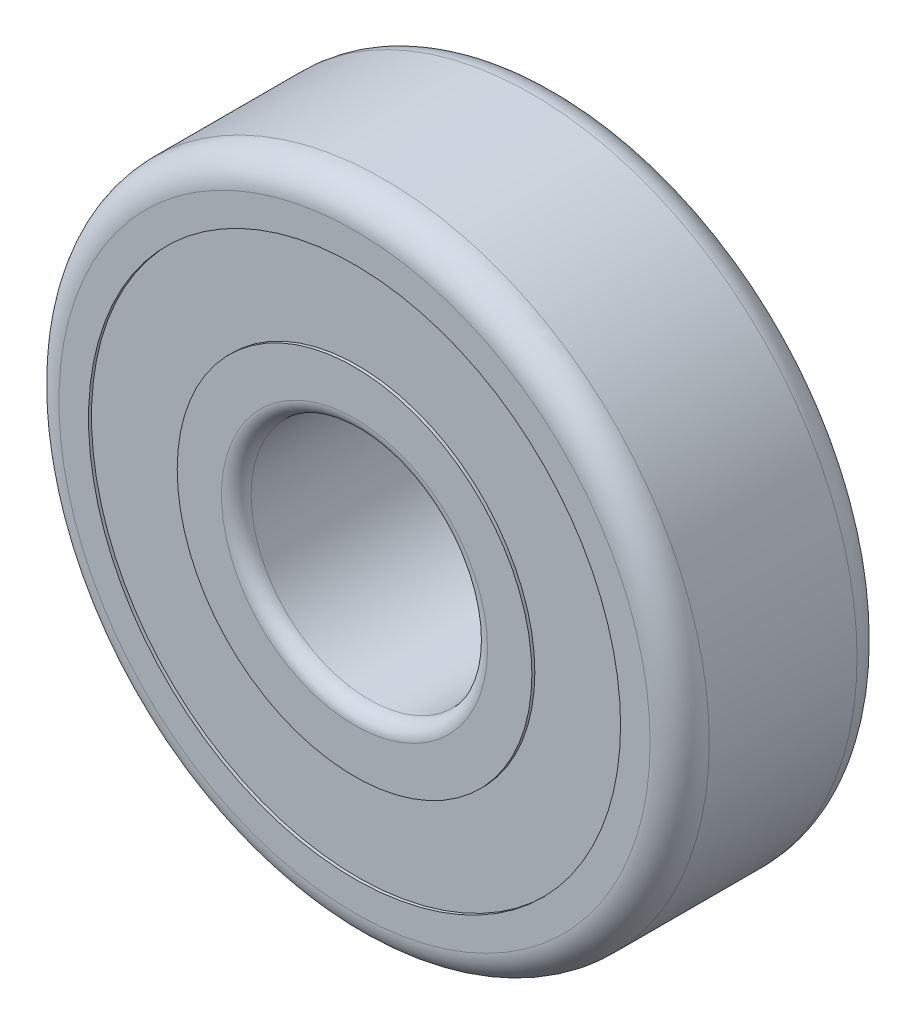
from build123d import *

# Parameters (mm, degrees)
SKETCH1_R           = 11
SKETCH1_R_2         = 4
BOSS_EXTRUDE1_DEPTH = 7
FILLET1_R           = 1
FILLET2_R           = 1
FILLET3_R           = 0.5
FILLET4_R           = 0.5
SKETCH2_R           = 9
SKETCH2_R_2         = 6
CUT_EXTRUDE1_DEPTH  = 0.1
CUT_EXTRUDE2_START  = -0.1
SKETCH3_R           = 9.2
SKETCH3_R_2         = 6
CUT_EXTRUDE2_DEPTH  = 0.1


with BuildPart() as part:
    # Sketch1 → Boss-Extrude1 (new body)
    with BuildSketch(Plane.XY):
        with Locations(Location((0, 0, 0), (0, 0, 180))):
            Circle(SKETCH1_R)
        with Locations(Location((0, 0, 0), (0, 0, 180))):
            Circle(SKETCH1_R_2, mode=Mode.SUBTRACT)
    extrude(amount=BOSS_EXTRUDE1_DEPTH)

    # Fillet1
    fillet1_edges = [part.edges().sort_by_distance(p)[0] for p in [
        (11, 0, 7),
    ]]
    fillet(fillet1_edges, radius=FILLET1_R)

    # Fillet2
    fillet2_edges = [part.edges().sort_by_distance(p)[0] for p in [
        (11, 0, 0),
    ]]
    fillet(fillet2_edges, radius=FILLET2_R)

    # Fillet3
    fillet3_edges = [part.edges().sort_by_distance(p)[0] for p in [
        (4, 0, 7),
    ]]
    fillet(fillet3_edges, radius=FILLET3_R)

    # Fillet4
    fillet4_edges = [part.edges().sort_by_distance(p)[0] for p in [
        (4, 0, 0),
    ]]
    fillet(fillet4_edges, radius=FILLET4_R)

    # Sketch2 → Cut-Extrude1 (cut)
    with BuildSketch(Plane.XY.offset(7)):
        Circle(SKETCH2_R)
        Circle(SKETCH2_R_2, mode=Mode.SUBTRACT)
    extrude(amount=-CUT_EXTRUDE1_DEPTH, mode=Mode.SUBTRACT)

    # Sketch3 → Cut-Extrude2 (cut)
    with BuildSketch(Plane(origin=(0, 0, 0), x_dir=(-1, 0, 0), z_dir=(0, 0, -1)).offset(CUT_EXTRUDE2_START)):
        Circle(SKETCH3_R)
        with Locations(Location((0, 0, 0), (0, 0, 180))):
            Circle(SKETCH3_R_2, mode=Mode.SUBTRACT)
    extrude(amount=CUT_EXTRUDE2_DEPTH, mode=Mode.SUBTRACT)


solid = part.part
